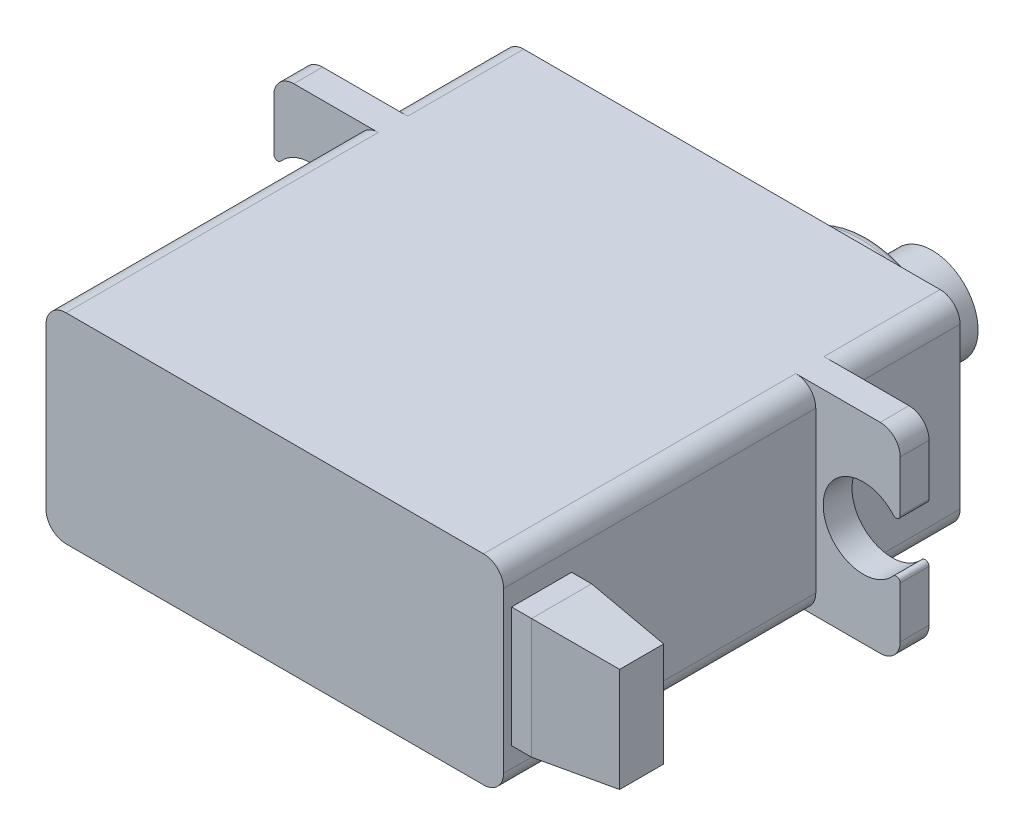
from build123d import *
from OCP.BRepFilletAPI import BRepFilletAPI_MakeChamfer

# Parameters (mm, degrees)
SKETCH1_W           = 39.751
SKETCH1_H           = 12.7
BOSS_EXTRUDE1_DEPTH = 1.8288
SKETCH2_W           = 29.0322
SKETCH2_H           = 12.7
BOSS_EXTRUDE2_DEPTH = 19.812
SKETCH3_W           = 28.956
SKETCH3_H           = 12.7
BOSS_EXTRUDE3_DEPTH = 7.366
SKETCH4_R           = 5.842
BOSS_EXTRUDE4_DEPTH = 1.27
SKETCH5_R           = 2.921
BOSS_EXTRUDE5_DEPTH = 4.064
SKETCH6_W           = 3.81
SKETCH6_H           = 7.62
BOSS_EXTRUDE6_DEPTH = 6.35
CHAMFER1_SIZE       = 5.08
CHAMFER1_SIZE2      = 0.508
FILLET1_R           = 1.27
CUT_EXTRUDE1_REACH  = 49.849
SKETCH7_R           = 2.54
FILLET2_R           = 0.254
FILLET3_R           = 0.508


with BuildPart() as part:
    # Sketch1 → Boss-Extrude1 (new body)
    with BuildSketch(Plane.XY):
        with Locations((19.8755, 6.35)):
            Rectangle(SKETCH1_W, SKETCH1_H)
    extrude(amount=BOSS_EXTRUDE1_DEPTH)

    # Sketch2 → Boss-Extrude2 (add)
    with BuildSketch(Plane.XY.offset(1.8288)):
        with Locations((19.8755, 6.35)):
            Rectangle(SKETCH2_W, SKETCH2_H)
    extrude(amount=BOSS_EXTRUDE2_DEPTH)

    # Sketch3 → Boss-Extrude3 (add)
    with BuildSketch(Plane(origin=(0, 0, 0), x_dir=(-1, 0, 0), z_dir=(0, 0, -1))):
        with Locations((-19.8755, 6.35)):
            Rectangle(SKETCH3_W, SKETCH3_H)
    extrude(amount=BOSS_EXTRUDE3_DEPTH)

    # Sketch4 → Boss-Extrude4 (add)
    with BuildSketch(Plane(origin=(0, 0, -7.366), x_dir=(-1, 0, 0), z_dir=(0, 0, -1))):
        with Locations((-27.2415, 6.35)):
            Circle(SKETCH4_R)
    extrude(amount=BOSS_EXTRUDE4_DEPTH)

    # Sketch5 → Boss-Extrude5 (add)
    with BuildSketch(Plane(origin=(0, 0, -8.636), x_dir=(-1, 0, 0), z_dir=(0, 0, -1))):
        with Locations((-27.2415, 6.35)):
            Circle(SKETCH5_R)
    extrude(amount=BOSS_EXTRUDE5_DEPTH)

    # Sketch6 → Boss-Extrude6 (add)
    with BuildSketch(Plane(origin=(34.3916, 0, 0), x_dir=(0, 0, -1), z_dir=(1, 0, 0))):
        with Locations((-19.2278, 6.35)):
            Rectangle(SKETCH6_W, SKETCH6_H)
    extrude(amount=BOSS_EXTRUDE6_DEPTH)

    # Chamfer1: one chamfer whose edges measure the first distance from different faces: ONE call of the kernel's chamfer builder (chamfer() names one face for all edges)
    chamfer1_edges_1 = [part.edges().sort_by_distance(p)[0] for p in [
        (40.7416, 6.35, 21.1328),
    ]]
    chamfer1_side_1 = [part.faces().sort_by_distance(p)[0] for p in [
        (37.5666, 6.35, 21.1328),
    ]]
    chamfer1_edges_2 = [part.edges().sort_by_distance(p)[0] for p in [
        (40.7416, 2.54, 19.2278),
    ]]
    chamfer1_side_2 = [part.faces().sort_by_distance(p)[0] for p in [
        (37.5666, 2.54, 19.2278),
    ]]
    chamfer1_edges_3 = [part.edges().sort_by_distance(p)[0] for p in [
        (40.7416, 6.35, 17.3228),
    ]]
    chamfer1_side_3 = [part.faces().sort_by_distance(p)[0] for p in [
        (37.5666, 6.35, 17.3228),
    ]]
    chamfer1_edges_4 = [part.edges().sort_by_distance(p)[0] for p in [
        (40.7416, 10.16, 19.2278),
    ]]
    chamfer1_side_4 = [part.faces().sort_by_distance(p)[0] for p in [
        (37.5666, 10.16, 19.2278),
    ]]
    chamfer1 = BRepFilletAPI_MakeChamfer(part.part.solid().wrapped)
    for e in chamfer1_edges_1:
        chamfer1.Add(CHAMFER1_SIZE, CHAMFER1_SIZE2, e.wrapped, chamfer1_side_1[0].wrapped)  # the first distance lies on this face
    for e in chamfer1_edges_2:
        chamfer1.Add(CHAMFER1_SIZE, CHAMFER1_SIZE2, e.wrapped, chamfer1_side_2[0].wrapped)  # the first distance lies on this face
    for e in chamfer1_edges_3:
        chamfer1.Add(CHAMFER1_SIZE, CHAMFER1_SIZE2, e.wrapped, chamfer1_side_3[0].wrapped)  # the first distance lies on this face
    for e in chamfer1_edges_4:
        chamfer1.Add(CHAMFER1_SIZE, CHAMFER1_SIZE2, e.wrapped, chamfer1_side_4[0].wrapped)  # the first distance lies on this face
    add(Compound.cast(chamfer1.Shape()), mode=Mode.REPLACE)

    # Fillet1
    fillet1_edges = [part.edges().sort_by_distance(p)[0] for p in [
        (5.3594, 12.7, 11.7348),
        (5.3594, 0, 11.7348),
        (34.3916, 0, 11.7348),
        (34.3916, 12.7, 11.7348),
        (34.3535, 12.7, -3.683),
        (34.3535, 0, -3.683),
        (5.3975, 0, -3.683),
        (5.3975, 12.7, -3.683),
        (0, 0, 0.9144),
        (39.751, 0, 0.9144),
        (39.751, 12.7, 0.9144),
        (0, 12.7, 0.9144),
    ]]
    fillet(fillet1_edges, radius=FILLET1_R)

    # Sketch7 → Cut-Extrude1 (cut, up to next)
    with BuildSketch(Plane(origin=(0, 0, 0), x_dir=(-1, 0, 0), z_dir=(0, 0, -1)), mode=Mode.PRIVATE) as cut_extrude1_sk1:
        with Locations((-37.4015, 6.35)):
            Circle(SKETCH7_R)
    cut_extrude1_tool1 = extrude(cut_extrude1_sk1.sketch, amount=-CUT_EXTRUDE1_REACH, mode=Mode.PRIVATE) & part.part
    # Sketch7 → Cut-Extrude1 (cut, up to next)
    with BuildSketch(Plane(origin=(0, 0, 0), x_dir=(-1, 0, 0), z_dir=(0, 0, -1)), mode=Mode.PRIVATE) as cut_extrude1_sk2:
        with Locations((-2.3495, 6.35)):
            Circle(SKETCH7_R)
    cut_extrude1_tool2 = extrude(cut_extrude1_sk2.sketch, amount=-CUT_EXTRUDE1_REACH, mode=Mode.PRIVATE) & part.part
    add(cut_extrude1_tool1.solids().sort_by_distance((37.4015, 6.35, 0))[0], mode=Mode.SUBTRACT)
    add(cut_extrude1_tool2.solids().sort_by_distance((2.3495, 6.35, 0))[0], mode=Mode.SUBTRACT)

    # Fillet2
    fillet2_edges = [part.edges().sort_by_distance(p)[0] for p in [
        (39.751, 7.315116444, 0.9144),
        (39.751, 5.384883556, 0.9144),
        (0, 7.315116444, 0.9144),
        (0, 5.384883556, 0.9144),
    ]]
    fillet(fillet2_edges, radius=FILLET2_R)

    # Fillet3
    fillet3_edges = [part.edges().sort_by_distance(p)[0] for p in [
        (33.0835, 6.35, -8.636),
    ]]
    fillet(fillet3_edges, radius=FILLET3_R)


solid = part.part
